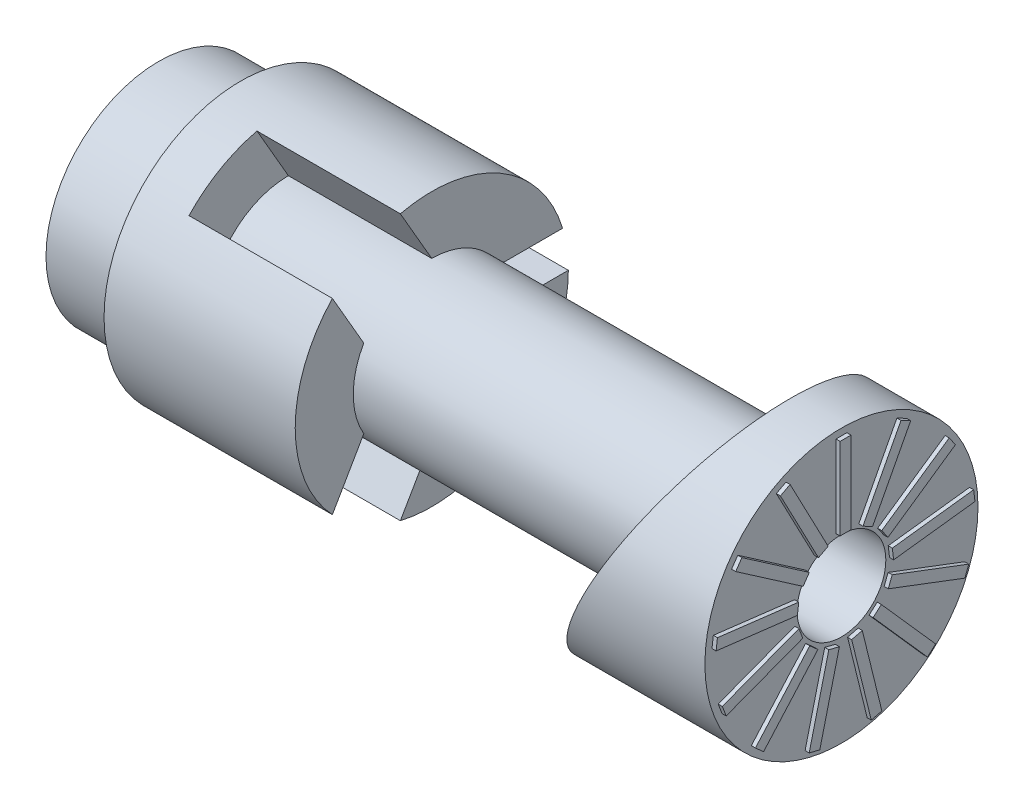
from build123d import *
from build123d.topology import SkipClean

# Parameters (mm, degrees)
CUT_EXTRUDE_1_DEPTH      = 10.5
CUT_EXTRUDE_2_DEPTH      = 52.961524227
CUT_EXTRUDE_2_DEPTH_BACK = 52.961524227
EXTRUDE_1_REACH          = 40.678
SKETCH_4_R               = 5.75
CUT_EXTRUDE_3_DEPTH      = 52.961524227
CUT_EXTRUDE_3_DEPTH_BACK = 52.961524227
SKETCH_5_R               = 3.25
SKETCH_6_W               = 0.8
SKETCH_6_H               = 6
EXTRUDE_2_DEPTH          = 0.3
PATTERN_CIRCULAR_1_COUNT = 13


with BuildPart() as part:
    # 草图1 → 旋转1 (revolve)
    with BuildSketch(Plane.XY):
        Polygon((36, 0), (0, 0), (0, -8.25), (6, -8.25), (6, -10), (20, -10), (20, -5.75), (36, -5.75), align=None)
    revolve(axis=Axis((0, 0, 0), (1, 0, 0)))

    # 草图2 → 切除-拉伸1 (cut)
    with SkipClean():  # the faces are left unmerged after this step: merging them gives an invalid solid
        with BuildSketch(Plane(origin=(20, 0, 0), x_dir=(0, 0, -1), z_dir=(1, 0, 0))):
            with BuildLine():
                ThreePointArc((4.979646072, 2.875), (5.554073501, 1.488209509), (5.75, 0))
                Line((5.75, 0), (10, 0))
                ThreePointArc((10, 0), (9.893888613, 1.452917105), (9.577806377, 2.875))
                Line((9.577806377, 2.875), (4.979646072, 2.875))
            make_face()
            with BuildLine():
                ThreePointArc((-4.979646072, 2.875), (-2.875, 4.979646072), (0, 5.75))
                Line((0, 5.75), (-2.299080153, 9.732123635))
                ThreePointArc((-2.299080153, 9.732123635), (-5, 8.660254038), (-7.278726225, 6.857123635))
                Line((-7.278726225, 6.857123635), (-4.979646072, 2.875))
            make_face()
            with BuildLine():
                Line((-2.299080153, -9.732123635), (0, -5.75))
                ThreePointArc((0, -5.75), (-2.875, -4.979646072), (-4.979646072, -2.875))
                Line((-4.979646072, -2.875), (-7.278726225, -6.857123635))
                ThreePointArc((-7.278726225, -6.857123635), (-5, -8.660254038), (-2.299080153, -9.732123635))
            make_face()
        extrude(amount=-CUT_EXTRUDE_1_DEPTH, mode=Mode.SUBTRACT)


with BuildPart() as body_2:
    # 草图1<3> → 旋转2 (revolve)
    with BuildSketch(Plane.XY):
        Polygon((50, 0), (36, 0), (36, -5.75), (36, -10), (50, -10), align=None)
    revolve(axis=Axis((0, 0, 0), (1, 0, 0)))

    # 草图3 → 切除-拉伸2 (cut, two sides: drawn at the far end of the back side and taken through both)
    with BuildSketch(Plane.XY.offset(-CUT_EXTRUDE_2_DEPTH_BACK)):
        Polygon((36, -10), (36, 10), (46.25, 10), align=None)
    extrude(amount=CUT_EXTRUDE_2_DEPTH + CUT_EXTRUDE_2_DEPTH_BACK, mode=Mode.SUBTRACT)

    # 草图4 → 凸台-拉伸1 (add, up to next)
    with BuildSketch(Plane(origin=(36, 0, 0), x_dir=(0, 0, -1), z_dir=(1, 0, 0)), mode=Mode.PRIVATE) as extrude_1_sk1:
        Circle(SKETCH_4_R)
    extrude_1_tool1 = extrude(extrude_1_sk1.sketch, amount=EXTRUDE_1_REACH, mode=Mode.PRIVATE) - body_2.part

    add(part.part)  # 凸台-拉伸1 merges part
    add(extrude_1_tool1.solids().sort_by_distance((36, 0, 0))[0])

    # 草图5 → 切除-拉伸3 (cut, two sides: drawn at the far end of the back side and taken through both)
    with BuildSketch(Plane(origin=(50, 0, 0), x_dir=(0, 0, -1), z_dir=(1, 0, 0)).offset(-CUT_EXTRUDE_3_DEPTH_BACK)):
        Circle(SKETCH_5_R)
    extrude(amount=CUT_EXTRUDE_3_DEPTH + CUT_EXTRUDE_3_DEPTH_BACK, mode=Mode.SUBTRACT)

    # 草图6 → 凸台-拉伸2 (add)
    with BuildSketch(Plane(origin=(50, 0, 0), x_dir=(0, 0, -1), z_dir=(1, 0, 0))):
        with Locations((0, 6.5)):
            Rectangle(SKETCH_6_W, SKETCH_6_H)
    extrude_2 = extrude(amount=EXTRUDE_2_DEPTH)

    # 阵列(圆周)1: 凸台-拉伸2 ×13 about axis
    pattern_circular_1_axis = Axis((50, 0, 0), (-1, 0, 0))
    for i in range(1, PATTERN_CIRCULAR_1_COUNT):
        add(extrude_2.rotate(pattern_circular_1_axis, i * 360 / PATTERN_CIRCULAR_1_COUNT))


solid = body_2.part
